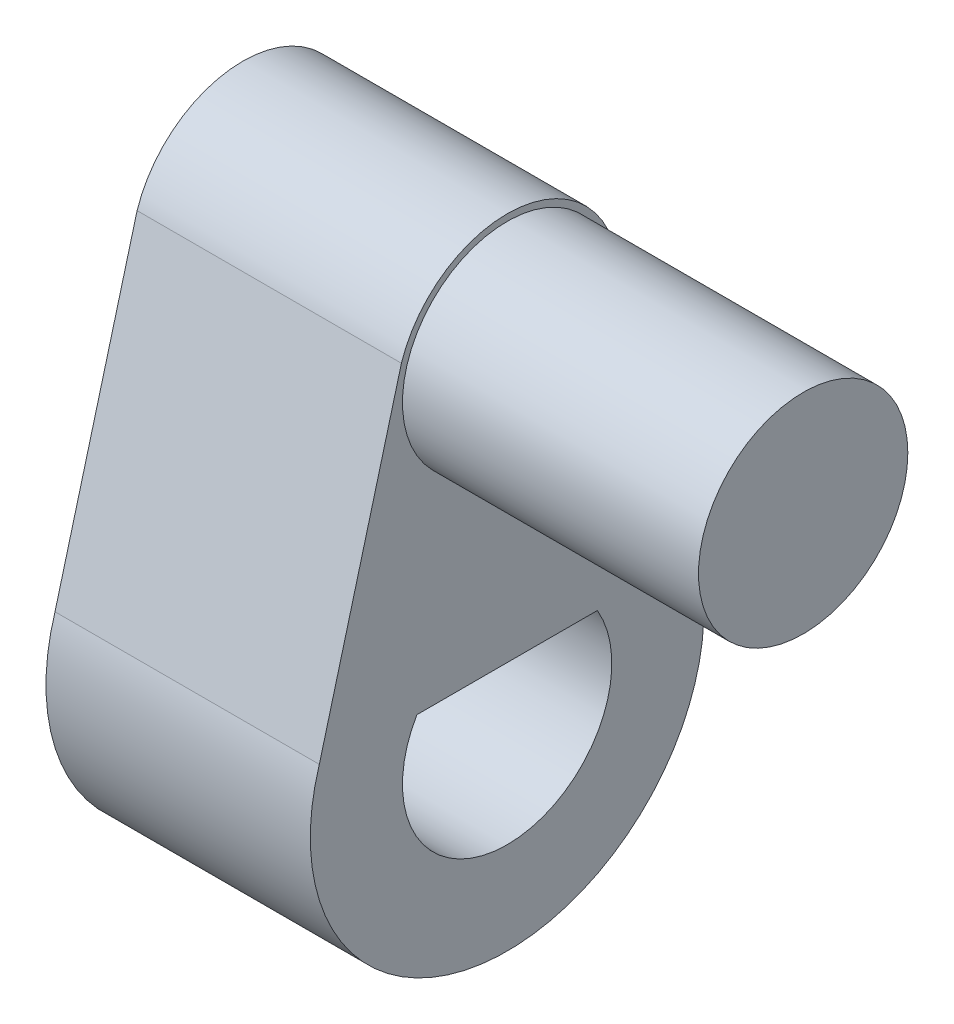
from build123d import *

# Parameters (mm, degrees)
BOSS_EXTRUDE2_DEPTH = 2.5
SKETCH4_R           = 0.99
CUT_EXTRUDE2_DEPTH  = 64.988660757
SKETCH6_R           = 0.99
BOSS_EXTRUDE4_DEPTH = 2.8
SKETCH7_W           = 2.01987101
SKETCH7_H           = 0.78494751
BOSS_EXTRUDE5_DEPTH = 2.5
FILLET1_R           = 0.2


with BuildPart() as part:
    # Sketch3 → Boss-Extrude2 (new body)
    with BuildSketch(Plane(origin=(0, 0, 0), x_dir=(0, 0, -1), z_dir=(1, 0, 0))):
        with BuildLine():
            Line((-54.67077374, 30.968825597), (-55.447230875, 28.071048118))
            ThreePointArc((-55.447230875, 28.071048118), (-53.67077374, 25.652507451), (-51.894316605, 28.071048118))
            Line((-51.894316605, 28.071048118), (-52.67077374, 30.968825597))
            ThreePointArc((-52.67077374, 30.968825597), (-53.67077374, 31.692969852), (-54.67077374, 30.968825597))
        make_face()
    extrude(amount=BOSS_EXTRUDE2_DEPTH)

    # Sketch4 → Cut-Extrude2 (cut, through all)
    with BuildSketch(Plane(origin=(2.5, 0, 0), x_dir=(0, 0, -1), z_dir=(1, 0, 0))):
        with Locations((-53.67077374, 27.514195996)):
            Circle(SKETCH4_R)
    extrude(amount=-CUT_EXTRUDE2_DEPTH, mode=Mode.SUBTRACT)

    # Sketch6 → Boss-Extrude4 (add)
    with BuildSketch(Plane(origin=(2.5, 0, 0), x_dir=(0, 0, -1), z_dir=(1, 0, 0))):
        with Locations((-53.67077374, 30.640427563)):
            Circle(SKETCH6_R)
    extrude(amount=BOSS_EXTRUDE4_DEPTH)

    # Sketch7 → Boss-Extrude5 (add)
    with BuildSketch(Plane(origin=(2.5, 0, 0), x_dir=(0, 0, -1), z_dir=(1, 0, 0))):
        with Locations((-53.657499813, 28.408869671)):
            Rectangle(SKETCH7_W, SKETCH7_H)
    extrude(amount=-BOSS_EXTRUDE5_DEPTH)

    # Fillet1
    fillet1_edges = [part.edges().sort_by_distance(p)[0] for p in [
        (0, 26.524195996, 53.67077374),
        (0, 28.016395916, 53.67077374),
    ]]
    fillet(fillet1_edges, radius=FILLET1_R)


solid = part.part
